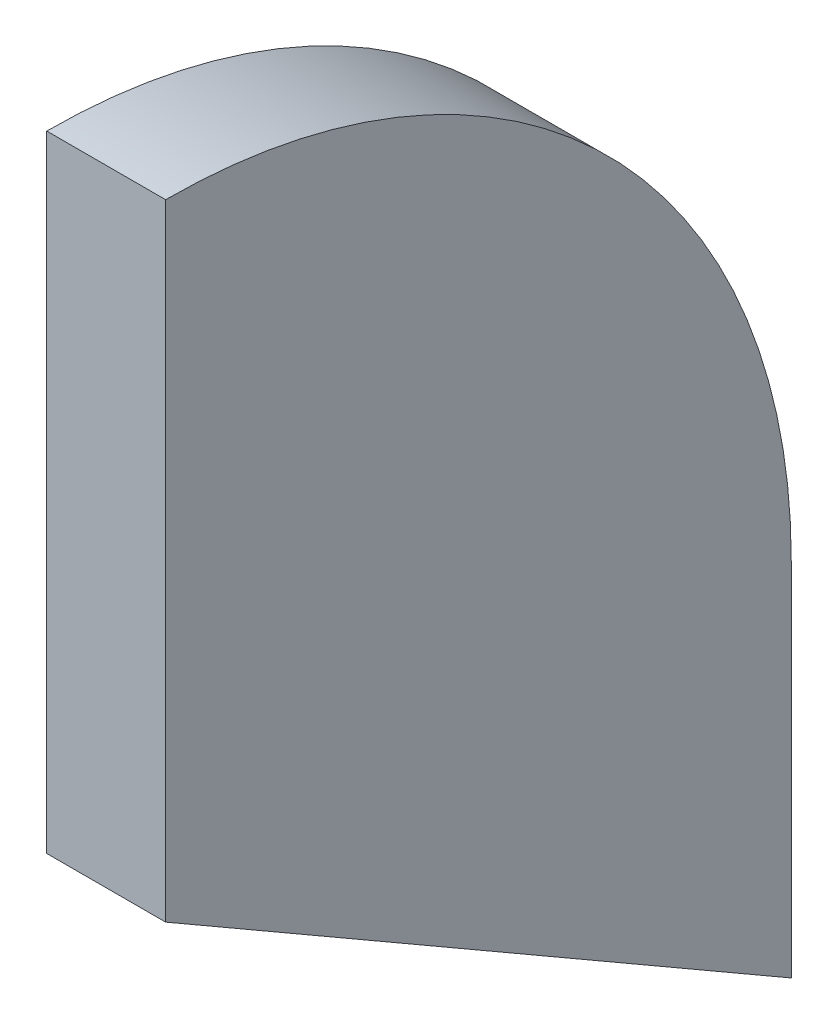
from build123d import *

# Parameters (mm, degrees)
BOSS_EXTRUDE1_DEPTH = 19


with BuildPart() as part:
    # Sketch1 → Boss-Extrude1 (new body)
    with BuildSketch(Plane(origin=(270.5, 0, 0), x_dir=(0, -1, 0), z_dir=(-1, 0, 0))):
        with BuildLine():
            Line((0, -100), (57.735026919, -100))
            Line((57.735026919, -100), (0, 0))
            Line((0, 0), (-100, 0))
            ThreePointArc((-100, 0), (-70.710678119, -70.710678119), (0, -100))
        make_face()
    extrude(amount=-BOSS_EXTRUDE1_DEPTH)


solid = part.part
